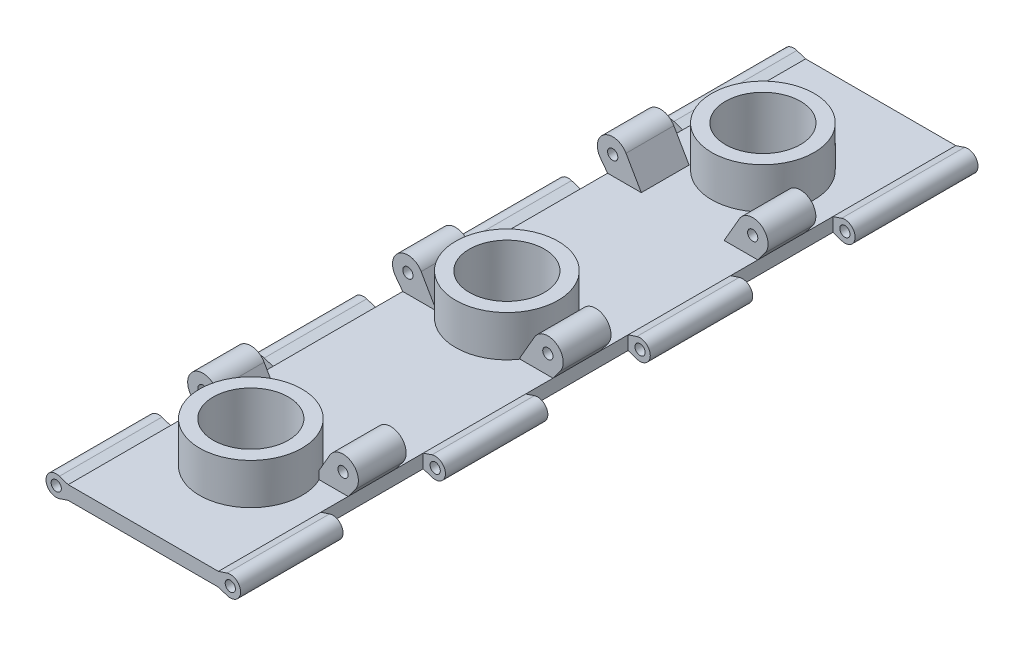
from build123d import *

# Parameters (mm, degrees)
SKETCH1_W                 = 22
SKETCH1_H                 = 4
SKETCH1_R                 = 3
SKETCH1_R_2               = 1.5
BOSS_EXTRUDE1_DEPTH       = 210
SKETCH2_R                 = 1.5
CUT_EXTRUDE2_DEPTH        = 30
LPATTERN1_COUNT           = 3
LPATTERN1_PITCH           = 60
SKETCH5_R                 = 4.5
SKETCH5_R_2               = 1.5
BOSS_EXTRUDE2_DEPTH       = 14
LPATTERN2_COUNT           = 3
LPATTERN2_PITCH           = 60
MIRROR3_COPY_1_SKETCH_R   = 1.5
MIRROR3_COPY_1_DEPTH      = 30
MIRROR3_COPY_2_SKETCH_R   = 1.5
MIRROR3_COPY_2_DEPTH      = 30
MIRROR3_COPY_3_SKETCH_R   = 4.5
MIRROR3_COPY_3_SKETCH_R_2 = 1.5
MIRROR3_COPY_3_DEPTH      = 14
MIRROR3_COPY_4_SKETCH_R   = 4.5
MIRROR3_COPY_4_SKETCH_R_2 = 1.5
MIRROR3_COPY_4_DEPTH      = 14
SKETCH6_R                 = 15
SKETCH6_R_2               = 11
BOSS_EXTRUDE3_DEPTH       = 12
SKETCH9_R                 = 11
CUT_EXTRUDE4_DEPTH        = 40.5
LPATTERN4_COUNT           = 3
LPATTERN4_PITCH           = 75
LPATTERN5_COUNT           = 3
LPATTERN5_PITCH           = 75
BOSS_EXTRUDE4_START       = 6
BOSS_EXTRUDE4_DEPTH       = 6
BOSS_EXTRUDE5_DEPTH       = 3
SKETCH20_W                = 171.257053273
SKETCH20_H                = 66.541862684
CUT_EXTRUDE7_DEPTH        = 6


with BuildPart() as part:
    # Sketch1 → Boss-Extrude1 (new body)
    # profile 1 of 3: a face of its own
    with BuildSketch(Plane.XY):
        with Locations((11, -11.489354466)):
            Rectangle(SKETCH1_W, SKETCH1_H)
    # profile 2 of 3: a face of its own
    with BuildSketch(Plane.XY):
        with BuildLine():
            Line((24.555722734, -8.641839682), (22, -9.489354466))
            Line((22, -9.489354466), (22, -13.489354466))
            Line((22, -13.489354466), (24.555722734, -14.336869249))
            ThreePointArc((24.555722734, -14.336869249), (22.5, -11.489354466), (24.555722734, -8.641839682))
        make_face()
    # profile 3 of 3: a face of its own
    with BuildSketch(Plane.XY):
        with Locations((25.5, -11.489354466)):
            Circle(SKETCH1_R)
        with Locations((25.5, -11.489354466)):
            Circle(SKETCH1_R_2, mode=Mode.SUBTRACT)
    boss_extrude1 = extrude(amount=-BOSS_EXTRUDE1_DEPTH)

    # Sketch2 → Cut-Extrude2 (cut)
    with BuildSketch(Plane.XY.offset(-30)):
        Polygon((22, -6.148469854), (22, -9.489354466), (22, -13.489354466), (22, -16.198394767), (29.348135307, -16.198394767), (29.348135307, -6.148469854), align=None)
        with Locations((25.5, -11.489354466)):
            Circle(SKETCH2_R, mode=Mode.SUBTRACT)
    cut_extrude2 = extrude(amount=-CUT_EXTRUDE2_DEPTH, mode=Mode.SUBTRACT)

    # LPattern1: Cut-Extrude2 ×3
    with Locations(*[(0, 0, -i * LPATTERN1_PITCH) for i in range(1, LPATTERN1_COUNT)]):
        add(cut_extrude2, mode=Mode.SUBTRACT)

    # Sketch5 → Boss-Extrude2 (add)
    # profile 1 of 2: a face of its own
    with BuildSketch(Plane.XY.offset(-38)):
        with BuildLine():
            ThreePointArc((24.1, -6.689354466), (18.020545578, -7.744658151), (16.602885683, -1.739354466))
            Line((16.602885683, -1.739354466), (12.128421097, -9.489354466))
            Line((12.128421097, -9.489354466), (22, -9.489354466))
            Line((22, -9.489354466), (24.1, -6.689354466))
        make_face()
    # profile 2 of 2: a face of its own
    with BuildSketch(Plane.XY.offset(-38)):
        with Locations((20.5, -3.989354466)):
            Circle(SKETCH5_R)
        with Locations((20.5, -3.989354466)):
            Circle(SKETCH5_R_2, mode=Mode.SUBTRACT)
    boss_extrude2 = extrude(amount=-BOSS_EXTRUDE2_DEPTH)

    # LPattern2: Boss-Extrude2 ×3
    with Locations(*[(0, 0, -i * LPATTERN2_PITCH) for i in range(1, LPATTERN2_COUNT)]):
        add(boss_extrude2)

    # Mirror3: Boss-Extrude1, Cut-Extrude2, Boss-Extrude2 across plane
    add(boss_extrude1.mirror(Plane(origin=(0, 0, -210), x_dir=(0, 0, 1), z_dir=(-1, 0, 0))))
    add(cut_extrude2.mirror(Plane(origin=(0, 0, -210), x_dir=(0, 0, 1), z_dir=(-1, 0, 0))), mode=Mode.SUBTRACT)
    add(boss_extrude2.mirror(Plane(origin=(0, 0, -210), x_dir=(0, 0, 1), z_dir=(-1, 0, 0))))

    # Mirror3 copy 1 sketch → Mirror3 copy 1 (cut)
    with BuildSketch(Plane(origin=(0, 0, -90), x_dir=(-1, 0, 0), z_dir=(0, 0, 1))):
        Polygon((22, 6.148469854), (22, 9.489354466), (22, 13.489354466), (22, 16.198394767), (29.348135307, 16.198394767), (29.348135307, 6.148469854), align=None)
        with Locations((25.5, 11.489354466)):
            Circle(MIRROR3_COPY_1_SKETCH_R, mode=Mode.SUBTRACT)
    extrude(amount=-MIRROR3_COPY_1_DEPTH, mode=Mode.SUBTRACT)

    # Mirror3 copy 2 sketch → Mirror3 copy 2 (cut)
    with BuildSketch(Plane(origin=(0, 0, -150), x_dir=(-1, 0, 0), z_dir=(0, 0, 1))):
        Polygon((22, 6.148469854), (22, 9.489354466), (22, 13.489354466), (22, 16.198394767), (29.348135307, 16.198394767), (29.348135307, 6.148469854), align=None)
        with Locations((25.5, 11.489354466)):
            Circle(MIRROR3_COPY_2_SKETCH_R, mode=Mode.SUBTRACT)
    extrude(amount=-MIRROR3_COPY_2_DEPTH, mode=Mode.SUBTRACT)

    # Mirror3 copy 3 sketch → Mirror3 copy 3 (add)
    # profile 1 of 2: a face of its own
    with BuildSketch(Plane(origin=(0, 0, -98), x_dir=(-1, 0, 0), z_dir=(0, 0, 1))):
        with BuildLine():
            ThreePointArc((24.1, 6.689354466), (18.020545578, 7.744658151), (16.602885683, 1.739354466))
            Line((16.602885683, 1.739354466), (12.128421097, 9.489354466))
            Line((12.128421097, 9.489354466), (22, 9.489354466))
            Line((22, 9.489354466), (24.1, 6.689354466))
        make_face()
    # profile 2 of 2: a face of its own
    with BuildSketch(Plane(origin=(0, 0, -98), x_dir=(-1, 0, 0), z_dir=(0, 0, 1))):
        with Locations((20.5, 3.989354466)):
            Circle(MIRROR3_COPY_3_SKETCH_R)
        with Locations((20.5, 3.989354466)):
            Circle(MIRROR3_COPY_3_SKETCH_R_2, mode=Mode.SUBTRACT)
    extrude(amount=-MIRROR3_COPY_3_DEPTH)

    # Mirror3 copy 4 sketch → Mirror3 copy 4 (add)
    # profile 1 of 2: a face of its own
    with BuildSketch(Plane(origin=(0, 0, -158), x_dir=(-1, 0, 0), z_dir=(0, 0, 1))):
        with BuildLine():
            ThreePointArc((24.1, 6.689354466), (18.020545578, 7.744658151), (16.602885683, 1.739354466))
            Line((16.602885683, 1.739354466), (12.128421097, 9.489354466))
            Line((12.128421097, 9.489354466), (22, 9.489354466))
            Line((22, 9.489354466), (24.1, 6.689354466))
        make_face()
    # profile 2 of 2: a face of its own
    with BuildSketch(Plane(origin=(0, 0, -158), x_dir=(-1, 0, 0), z_dir=(0, 0, 1))):
        with Locations((20.5, 3.989354466)):
            Circle(MIRROR3_COPY_4_SKETCH_R)
        with Locations((20.5, 3.989354466)):
            Circle(MIRROR3_COPY_4_SKETCH_R_2, mode=Mode.SUBTRACT)
    extrude(amount=-MIRROR3_COPY_4_DEPTH)

    # Sketch6 → Boss-Extrude3 (add)
    with BuildSketch(Plane(origin=(0, -9.489354466, 0), x_dir=(1, 0, 0), z_dir=(0, 1, 0))):
        with Locations(Location((0, 181.5, 0), (0, 0, 90))):
            Circle(SKETCH6_R)
        with Locations(Location((0, 181.5, 0), (0, 0, 270))):
            Circle(SKETCH6_R_2, mode=Mode.SUBTRACT)
    boss_extrude3 = extrude(amount=BOSS_EXTRUDE3_DEPTH)

    # Sketch9 → Cut-Extrude4 (cut, symmetric)
    with BuildSketch(Plane(origin=(0, -9.489354466, 0), x_dir=(1, 0, 0), z_dir=(0, 1, 0))):
        with Locations(Location((0, 181.5, 0), (0, 0, 90))):
            Circle(SKETCH9_R)
    cut_extrude4 = extrude(amount=CUT_EXTRUDE4_DEPTH, both=True, mode=Mode.SUBTRACT)

    # LPattern4: Boss-Extrude3 ×3
    with Locations(*[(0, 0, i * LPATTERN4_PITCH) for i in range(1, LPATTERN4_COUNT)]):
        add(boss_extrude3)

    # LPattern5: Cut-Extrude4 ×3
    with Locations(*[(0, 0, i * LPATTERN5_PITCH) for i in range(1, LPATTERN5_COUNT)]):
        add(cut_extrude4, mode=Mode.SUBTRACT)

    # Sketch15 → Boss-Extrude4 (add)
    with BuildSketch(Plane.XY.offset(BOSS_EXTRUDE4_START)):
        with BuildLine():
            Line((-22, -9.489354466), (22, -9.489354466))
            Line((22, -9.489354466), (24.555722734, -8.641839682))
            ThreePointArc((24.555722734, -8.641839682), (28.5, -11.489354466), (24.555722734, -14.336869249))
            Line((24.555722734, -14.336869249), (22, -13.489354466))
            Line((22, -13.489354466), (-22, -13.489354466))
            Line((-22, -13.489354466), (-24.555722734, -14.336869249))
            ThreePointArc((-24.555722734, -14.336869249), (-28.5, -11.489354466), (-24.555722734, -8.641839682))
            Line((-24.555722734, -8.641839682), (-22, -9.489354466))
        make_face()
    boss_extrude4 = extrude(amount=-BOSS_EXTRUDE4_DEPTH)

    # Sketch16 → Boss-Extrude5 (add)
    with BuildSketch(Plane.XY.offset(6)):
        Polygon((-22, -13.489354466), (-22, -14.489354466), (-17, -23.489354466), (17, -23.489354466), (22, -14.489354466), (22, -13.489354466), align=None)
    boss_extrude5 = extrude(amount=-BOSS_EXTRUDE5_DEPTH)

    # Mirror6: Boss-Extrude4, Boss-Extrude5 across plane
    add(boss_extrude4.mirror(Plane(origin=(0, 0, -105), x_dir=(1, 0, 0), z_dir=(0, 0, -1))))
    add(boss_extrude5.mirror(Plane(origin=(0, 0, -105), x_dir=(1, 0, 0), z_dir=(0, 0, -1))))

    # Sketch20 → Cut-Extrude7 (cut)
    with BuildSketch(Plane.XY.offset(6)):
        with Locations((-24.250521665, -15.687669002)):
            Rectangle(SKETCH20_W, SKETCH20_H)
    extrude(amount=-CUT_EXTRUDE7_DEPTH, mode=Mode.SUBTRACT)


solid = part.part
